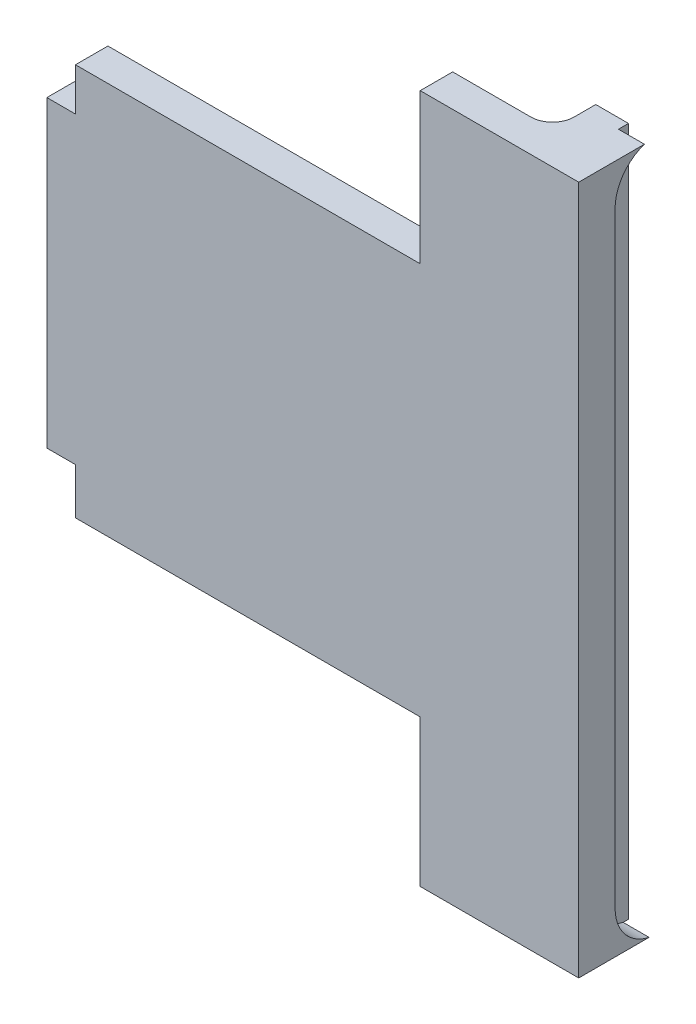
from build123d import *

# Parameters (mm, degrees)
BOSS_EXTRUDE1_DEPTH = 1.5
SKETCH2_W           = 2.713539356
SKETCH2_H           = 31.847242959
BOSS_EXTRUDE2_DEPTH = 2
CUT_EXTRUDE1_DEPTH  = 0.75
FILLET1_R           = 1
FILLET2_R           = 0.3
CUT_EXTRUDE2_DEPTH  = 1.2


with BuildPart() as part:
    # Sketch1 → Boss-Extrude1 (new body)
    with BuildSketch(Plane.XY):
        Polygon((13.150722075, -0.506964629), (13.150722075, -7.292554302), (20.475117676, -7.292554302), (20.475117676, 24.554688657), (13.150722075, 24.554688657), (13.150722075, 17.625640453), (-2.779550764, 17.625640453), (-2.779550764, 15.652441277), (-4.09999988, 15.652441277), (-4.09999988, 1.623886225), (-2.779550764, 1.623886225), (-2.779550764, -0.506964629), align=None)
    extrude(amount=-BOSS_EXTRUDE1_DEPTH)

    # Sketch2 → Boss-Extrude2 (add)
    with BuildSketch(Plane(origin=(0, 0, -1.5), x_dir=(-1, 0, 0), z_dir=(0, 0, -1))):
        with Locations((-19.118347998, 8.631067178)):
            Rectangle(SKETCH2_W, SKETCH2_H)
    extrude(amount=BOSS_EXTRUDE2_DEPTH)

    # Sketch3 → Cut-Extrude1 (cut)
    with BuildSketch(Plane(origin=(0, 0, -1.5), x_dir=(-1, 0, 0), z_dir=(0, 0, -1))):
        Polygon((2.779550764, 15.589201664), (-9.466641169, 15.589201664), (-9.466641169, 1.649000414), (2.779550764, 1.649000414), (2.779550764, 1.623886225), (4.09999988, 1.623886225), (4.09999988, 15.589201664), align=None)
    extrude(amount=-CUT_EXTRUDE1_DEPTH, mode=Mode.SUBTRACT)

    # Fillet1
    fillet1_edges = [part.edges().sort_by_distance(p)[0] for p in [
        (17.76157832, 8.631067178, -1.5),
    ]]
    fillet(fillet1_edges, radius=FILLET1_R)

    # Fillet2
    fillet2_edges = [part.edges().sort_by_distance(p)[0] for p in [
        (3.343545202, 1.649000414, -1.5),
        (9.466641169, 8.619101039, -1.5),
        (2.683320645, 15.589201664, -1.5),
    ]]
    fillet(fillet2_edges, radius=FILLET2_R)

    # Sketch4 → Cut-Extrude2 (cut)
    with BuildSketch(Plane(origin=(20.475117676, 0, 0), x_dir=(0, 0, -1), z_dir=(1, 0, 0))):
        with BuildLine():
            Line((1.679428172, 22.66130131), (1.679429396, -5.33869869))
            ThreePointArc((1.679429396, -5.33869869), (2.265215896, -6.752912227), (3.679429484, -7.338698602))
            Line((3.679429484, -7.338698602), (3.679428085, 24.661301398))
            ThreePointArc((3.679428085, 24.661301398), (2.265214548, 24.075514898), (1.679428172, 22.66130131))
        make_face()
    extrude(amount=-CUT_EXTRUDE2_DEPTH, mode=Mode.SUBTRACT)


solid = part.part
